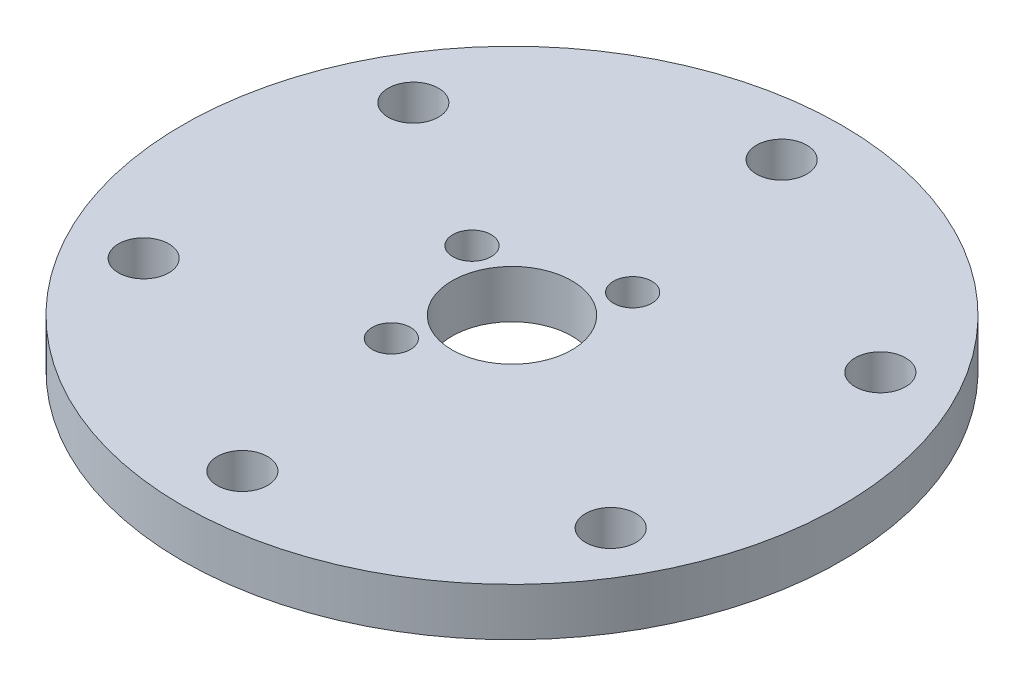
from build123d import *

# Parameters (mm, degrees)
SKETCH1_R           = 27.5
SKETCH1_R_2         = 2.1
SKETCH1_R_3         = 5
BOSS_EXTRUDE1_DEPTH = 4
SKETCH2_R           = 1.6
CUT_EXTRUDE1_DEPTH  = 40.096035605


with BuildPart() as part:
    # Sketch1 → Boss-Extrude1 (new body)
    with BuildSketch(Plane(origin=(0, 0, 0), x_dir=(1, 0, 0), z_dir=(0, 1, 0))):
        with Locations(Location((0, 0, 0), (0, 0, 270))):
            Circle(SKETCH1_R)
        with Locations(Location((0, 22.5, 0), (0, 0, 270))):
            Circle(SKETCH1_R_2, mode=Mode.SUBTRACT)
        with Locations(Location((19.485571585, 11.25, 0), (0, 0, 270))):
            Circle(SKETCH1_R_2, mode=Mode.SUBTRACT)
        with Locations(Location((19.485571585, -11.25, 0), (0, 0, 270))):
            Circle(SKETCH1_R_2, mode=Mode.SUBTRACT)
        with Locations(Location((0, -22.5, 0), (0, 0, 270))):
            Circle(SKETCH1_R_2, mode=Mode.SUBTRACT)
        with Locations(Location((-19.485571585, -11.25, 0), (0, 0, 270))):
            Circle(SKETCH1_R_2, mode=Mode.SUBTRACT)
        with Locations(Location((-19.485571585, 11.25, 0), (0, 0, 270))):
            Circle(SKETCH1_R_2, mode=Mode.SUBTRACT)
        with Locations(Location((0, 0, 0), (0, 0, 270))):
            Circle(SKETCH1_R_3, mode=Mode.SUBTRACT)
    extrude(amount=BOSS_EXTRUDE1_DEPTH)

    # Sketch2 → Cut-Extrude1 (cut, through all)
    with BuildSketch(Plane.XZ):
        with Locations(Location((3.365691748, -6.702396516, 0), (0, 0, 270))):
            Circle(SKETCH2_R)
        with Locations(Location((-6.702396516, -3.365691748, 0), (0, 0, 270))):
            Circle(SKETCH2_R)
        with Locations(Location((-3.365691748, 6.702396516, 0), (0, 0, 270))):
            Circle(SKETCH2_R)
    extrude(amount=-CUT_EXTRUDE1_DEPTH, mode=Mode.SUBTRACT)


solid = part.part
